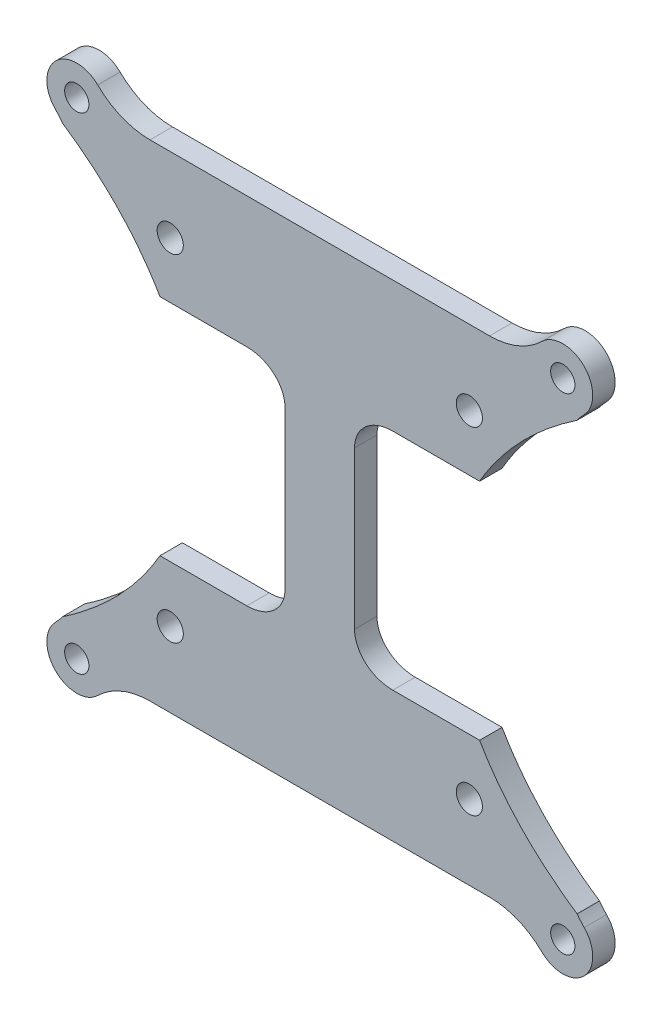
from build123d import *

# Parameters (mm, degrees)
SKETCH_1_R          = 1.625
EXTRUDE_1_DEPTH     = 3
FILLET_1_R          = 10
SKETCH_2_R          = 1.75
CUT_EXTRUDE_1_DEPTH = 10
CUT_EXTRUDE_START   = -10
CUT_EXTRUDE_2_DEPTH = 10


with BuildPart() as part:
    # Эскиз1 → Бобышка-Вытянуть1 (new body)
    with BuildSketch(Plane.XY):
        with BuildLine():
            ThreePointArc((-32.5, -28.5), (-35.328427125, -35.328427125), (-28.5, -32.5))
            Line((-28.5, -32.5), (28.5, -32.5))
            ThreePointArc((28.5, -32.5), (35.328427125, -35.328427125), (32.5, -28.5))
            Line((32.5, -28.5), (32.5, 28.5))
            ThreePointArc((32.5, 28.5), (35.328427125, 35.328427125), (28.5, 32.5))
            Line((28.5, 32.5), (-28.5, 32.5))
            ThreePointArc((-28.5, 32.5), (-35.328427125, 35.328427125), (-32.5, 28.5))
            Line((-32.5, 28.5), (-32.5, -28.5))
        make_face()
        with Locations((-32.5, -32.5)):
            Circle(SKETCH_1_R, mode=Mode.SUBTRACT)
        with Locations((32.5, 32.5)):
            Circle(SKETCH_1_R, mode=Mode.SUBTRACT)
        with Locations((-32.5, 32.5)):
            Circle(SKETCH_1_R, mode=Mode.SUBTRACT)
        with Locations((32.5, -32.5)):
            Circle(SKETCH_1_R, mode=Mode.SUBTRACT)
    extrude(amount=EXTRUDE_1_DEPTH)

    # Скругление1
    fillet_1_edges = [part.edges().sort_by_distance(p)[0] for p in [
        (-32.5, -28.5, 1.5),
        (-32.5, 28.5, 1.5),
        (-28.5, 32.5, 1.5),
        (28.5, 32.5, 1.5),
        (32.5, 28.5, 1.5),
        (32.5, -28.5, 1.5),
        (28.5, -32.5, 1.5),
        (-28.5, -32.5, 1.5),
    ]]
    fillet(fillet_1_edges, radius=FILLET_1_R)

    # Эскиз2 → Вырез-Вытянуть1 (cut)
    with BuildSketch(Plane(origin=(0, 0, 0), x_dir=(-1, 0, 0), z_dir=(0, 0, -1))):
        with Locations((-20, 22.5)):
            Circle(SKETCH_2_R)
        with Locations(Location((20, 22.5, 0), (0, 0, 180))):
            Circle(SKETCH_2_R)
        with Locations((20, -22.5)):
            Circle(SKETCH_2_R)
        with Locations(Location((-20, -22.5, 0), (0, 0, 180))):
            Circle(SKETCH_2_R)
    extrude(amount=-CUT_EXTRUDE_1_DEPTH, mode=Mode.SUBTRACT)

    # Эскиз3 → Вырез-Вытянуть2 (cut)
    with BuildSketch(Plane(origin=(0, 0, 0), x_dir=(-1, 0, 0), z_dir=(0, 0, -1)).offset(CUT_EXTRUDE_START)):
        with BuildLine():
            ThreePointArc((-32.527489622, -23.443011177), (-33.111487572, -26.145271254), (-34.41307423, -28.584356184))
            add(Edge.make_bspline(
                [(-21.375247121, -15), (-21.837243406, -15.807037469), (-22.815077284, -17.366302748), (-25.110100773, -20.461656809), (-28.548566388, -24.142111027), (-32.105145522, -27.003843019), (-34.159091146, -28.413411533), (-34.41307423, -28.584356184)],
                knots=[0.041506699, 0.041506699, 0.041506699, 0.041506699, 0.10141253, 0.161318362, 0.281130024, 0.400941687, 0.417671357, 0.417671357, 0.417671357, 0.417671357], degree=3))
            Line((-21.375247121, -15), (-9.767766953, -15))
            add(Edge.make_bspline(
                [(-4.646446609, -10.5), (-4.646446609, -11.195491949), (-5.02770668, -12.620388587), (-6.499735229, -14.141611525), (-7.906330267, -14.751989256), (-9.003254917, -14.968962036), (-9.508808337, -15), (-9.767766953, -15)],
                knots=[0, 0, 0, 0, 0.25, 0.5, 0.75, 0.875, 1, 1, 1, 1], degree=3))
            Line((-4.646446609, -10.5), (-4.646446609, 10.5))
            add(Edge.make_bspline(
                [(-9.767766953, 15), (-9.508808337, 15), (-9.003254917, 14.968962036), (-7.906330267, 14.751989256), (-6.499735229, 14.141611525), (-5.02770668, 12.620388587), (-4.646446609, 11.195491949), (-4.646446609, 10.5)],
                knots=[0, 0, 0, 0, 0.125, 0.25, 0.5, 0.75, 1, 1, 1, 1], degree=3))
            Line((-9.767766953, 15), (-21.375246423, 15))
            add(Edge.make_bspline(
                [(-34.413080182, 28.584364367), (-34.159090219, 28.413415142), (-32.105139192, 27.003842637), (-28.548557361, 24.142106491), (-25.110095557, 20.461653929), (-22.815074777, 17.366301448), (-21.837242114, 15.807037015), (-21.375246423, 15)],
                knots=[0.582328153, 0.582328153, 0.582328153, 0.582328153, 0.599058284, 0.718869941, 0.838681597, 0.898587426, 0.958493254, 0.958493254, 0.958493254, 0.958493254], degree=3))
            ThreePointArc((-34.413080182, 28.584364367), (-33.111490075, 26.145278078), (-32.52748995, 23.443015585))
            add(Edge.make_bspline(
                [(-32.52748995, 23.443015585), (-28.375728659, 20.01802535), (-25.24455418, 16.149809293), (-23.169847522, 12)],
                knots=[0.670058199, 0.670058199, 0.670058199, 0.670058199, 1, 1, 1, 1], degree=3, weights=[0.931160567, 0.942808023, 0.965754501, 1]))
            Line((-23.169847522, 12), (-9.767766953, 12))
            add(Edge.make_bspline(
                [(-9.767766953, 12), (-8.525126266, 12), (-7.646446609, 11.378679656), (-7.646446609, 10.5)],
                knots=[0, 0, 0, 0, 1, 1, 1, 1], degree=3, weights=[1, 0.804737854, 0.804737854, 1]))
            Line((-7.646446609, 10.5), (-7.646446609, -10.5))
            add(Edge.make_bspline(
                [(-7.646446609, -10.5), (-7.646446609, -11.378679656), (-8.525126266, -12), (-9.767766953, -12)],
                knots=[0, 0, 0, 0, 1, 1, 1, 1], degree=3, weights=[1, 0.804737854, 0.804737854, 1]))
            Line((-9.767766953, -12), (-23.169847522, -12))
            add(Edge.make_bspline(
                [(-23.169847522, -12), (-25.244555327, -16.149807692), (-28.375729667, -20.018022166), (-32.527489622, -23.443011177)],
                knots=[0, 0, 0, 0, 0.329941488, 0.329941488, 0.329941488, 0.329941488], degree=3, weights=[1, 0.965754533, 0.942808067, 0.9311606]))
        make_face()
        with BuildLine():
            ThreePointArc((34.413079829, -28.584363881), (33.111489843, -26.145277446), (32.527489894, -23.443014841))
            add(Edge.make_bspline(
                [(32.527489894, -23.443014841), (28.375728829, -20.018024812), (25.244554374, -16.149809022), (23.169847522, -12)],
                knots=[0.670058252, 0.670058252, 0.670058252, 0.670058252, 1, 1, 1, 1], degree=3, weights=[0.931160573, 0.942808031, 0.965754506, 1]))
            Line((23.169847522, -12), (9.767766953, -12))
            add(Edge.make_bspline(
                [(9.767766953, -12), (8.525126266, -12), (7.646446609, -11.378679656), (7.646446609, -10.5)],
                knots=[0, 0, 0, 0, 1, 1, 1, 1], degree=3, weights=[1, 0.804737854, 0.804737854, 1]))
            Line((7.646446609, -10.5), (7.646446609, 10.5))
            add(Edge.make_bspline(
                [(7.646446609, 10.5), (7.646446609, 11.378679656), (8.525126266, 12), (9.767766953, 12)],
                knots=[0, 0, 0, 0, 1, 1, 1, 1], degree=3, weights=[1, 0.804737854, 0.804737854, 1]))
            Line((9.767766953, 12), (23.169847522, 12))
            add(Edge.make_bspline(
                [(23.169847522, 12), (25.244551608, 16.149812881), (28.375726398, 20.018032487), (32.527490684, 23.443025466)],
                knots=[0, 0, 0, 0, 0.329942503, 0.329942503, 0.329942503, 0.329942503], degree=3, weights=[1, 0.965754428, 0.942807926, 0.931160493]))
            ThreePointArc((32.527490684, 23.443025466), (33.111495685, 26.145293377), (34.413093524, 28.58438271))
            add(Edge.make_bspline(
                [(34.413093524, 28.58438271), (34.15908814, 28.413423233), (32.105125, 27.003841781), (28.548537123, 24.142096322), (25.110083863, 20.461647473), (22.815069156, 17.366298535), (21.837239216, 15.807035997), (21.37524486, 15)],
                knots=[0.623833905, 0.623833905, 0.623833905, 0.623833905, 0.640565069, 0.760376713, 0.880188356, 0.940094178, 1, 1, 1, 1], degree=3))
            Line((21.37524486, 15), (9.767766953, 15))
            add(Edge.make_bspline(
                [(9.767766953, 15), (9.508808337, 15), (9.003254917, 14.968962036), (7.906330267, 14.751989256), (6.499735229, 14.141611525), (5.02770668, 12.620388587), (4.646446609, 11.195491949), (4.646446609, 10.5)],
                knots=[0, 0, 0, 0, 0.125, 0.25, 0.5, 0.75, 1, 1, 1, 1], degree=3))
            Line((4.646446609, 10.5), (4.646446609, -10.5))
            add(Edge.make_bspline(
                [(4.646446609, -10.5), (4.646446609, -11.195491949), (5.02770668, -12.620388587), (6.499735229, -14.141611525), (7.906330267, -14.751989256), (9.003254917, -14.968962036), (9.508808337, -15), (9.767766953, -15)],
                knots=[0, 0, 0, 0, 0.25, 0.5, 0.75, 0.875, 1, 1, 1, 1], degree=3))
            Line((9.767766953, -15), (21.375246541, -15))
            add(Edge.make_bspline(
                [(21.375246541, -15), (21.837559693, -15.807591474), (22.816100456, -17.367890887), (25.112994349, -20.465265714), (28.554552568, -24.147931842), (32.110993648, -27.008206413), (34.162781762, -28.415899337), (34.413079829, -28.584363881)],
                knots=[-0.000648378, -0.000648378, -0.000648378, -0.000648378, 0.059297975, 0.119244327, 0.239137032, 0.359029737, 0.375516672, 0.375516672, 0.375516672, 0.375516672], degree=3))
        make_face()
    extrude(amount=CUT_EXTRUDE_2_DEPTH, mode=Mode.SUBTRACT)


with BuildPart() as cut_extrude_2_kept_piece:
    # of the separate pieces the step leaves, the one the design keeps (cut_extrude_2_pieces_kept)
    add(part.part.solids().sort_by_distance((-34.413093524, 28.58438271, 0))[0])


solid = cut_extrude_2_kept_piece.part
